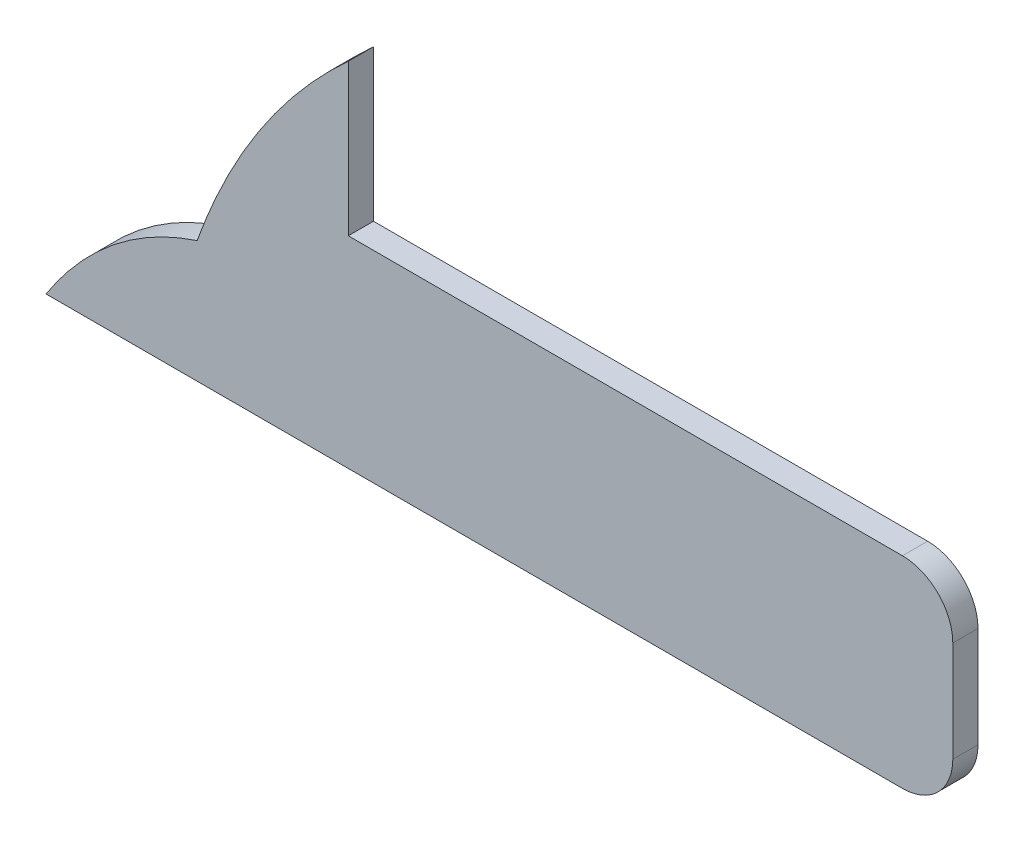
from build123d import *

# Parameters (mm, degrees)
BOSS_EXTRUDE1_DEPTH = 12.7


with BuildPart() as part:
    # Sketch2 → Boss-Extrude1 (new body)
    with BuildSketch(Plane.XY):
        with BuildLine():
            Line((0, 0), (431.8, 0))
            ThreePointArc((431.8, 0), (449.760512242, 7.439487758), (457.2, 25.4))
            Line((457.2, 25.4), (457.2, 76.2))
            ThreePointArc((457.2, 76.2), (449.760512242, 94.160512242), (431.8, 101.6))
            Line((431.8, 101.6), (152.4, 101.6))
            Line((152.4, 101.6), (152.4, 177.8))
            add(Edge.make_bspline(
                [(76.2, 61.401256844), (101.247409755, 131.199229676), (152.4, 177.8)],
                knots=[0, 0, 0, 0.857766608, 0.857766608, 0.857766608], degree=2))
            add(Edge.make_bspline(
                [(0, 0), (29.783016718, 46.127848409), (76.2, 61.401256844)],
                knots=[0, 0, 0, 0.939645984, 0.939645984, 0.939645984], degree=2))
        make_face()
    extrude(amount=BOSS_EXTRUDE1_DEPTH)


solid = part.part
